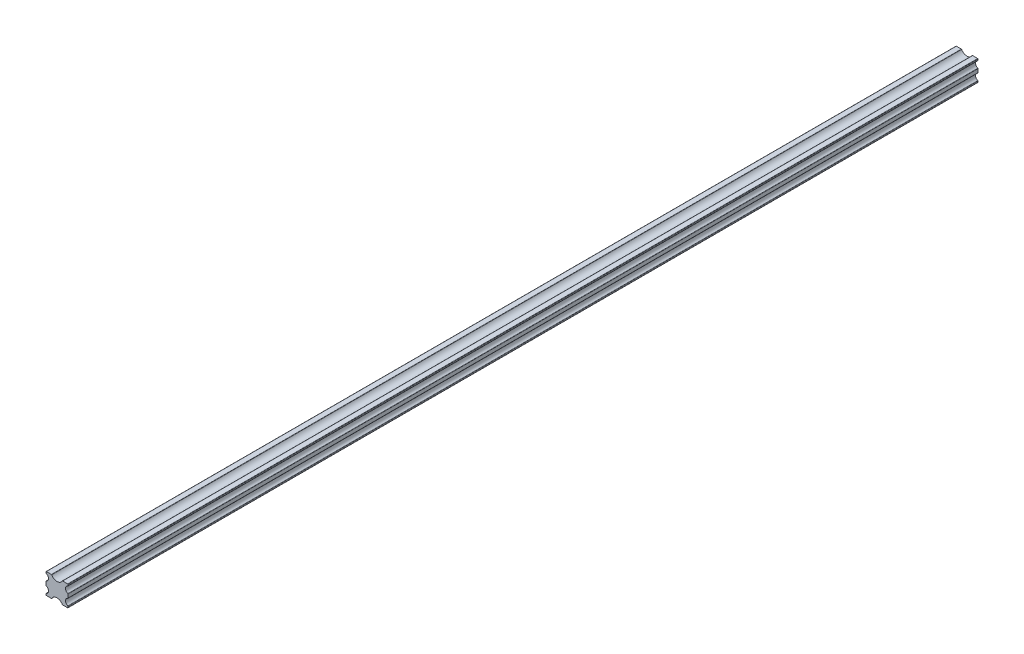
from build123d import *

# Parameters (mm, degrees)
SKETCH1_W           = 12.1
SKETCH1_H           = 11.4
BOSS_EXTRUDE1_DEPTH = 500
SKETCH2_R           = 3.379
SKETCH2_R_2         = 1.9
CUT_EXTRUDE1_DEPTH  = 501.069087727
FILLET1_R           = 0.2


with BuildPart() as part:
    # Sketch1 → Boss-Extrude1 (new body)
    with BuildSketch(Plane.XY):
        Rectangle(SKETCH1_W, SKETCH1_H)
    extrude(amount=BOSS_EXTRUDE1_DEPTH)

    # Sketch2 → Cut-Extrude1 (cut, through all)
    with BuildSketch(Plane.XY.offset(500)):
        with Locations((0, 7.279)):
            Circle(SKETCH2_R)
        with Locations((0, -7.279)):
            Circle(SKETCH2_R)
        with Locations((-6.565, 2.930166572)):
            Circle(SKETCH2_R_2)
        with Locations((-6.565, -2.930166572)):
            Circle(SKETCH2_R_2)
        with Locations((6.565, -2.930166572)):
            Circle(SKETCH2_R_2)
        with Locations((6.565, 2.930166572)):
            Circle(SKETCH2_R_2)
    extrude(amount=-CUT_EXTRUDE1_DEPTH, mode=Mode.SUBTRACT)

    # Fillet1
    fillet1_edges = [part.edges().sort_by_distance(p)[0] for p in [
        (6.05, -4.759039176, 250),
        (6.05, -1.101293968, 250),
        (-6.05, -1.101293968, 250),
        (-6.05, -4.759039176, 250),
        (-6.05, 4.759039176, 250),
        (-6.05, 1.101293968, 250),
        (-2.987373428, -5.7, 250),
        (2.987373428, -5.7, 250),
        (6.05, 1.101293968, 250),
        (6.05, 4.759039176, 250),
        (2.987373428, 5.7, 250),
        (-2.987373428, 5.7, 250),
        (6.05, -5.7, 250),
        (-6.05, -5.7, 250),
        (-6.05, 5.7, 250),
        (6.05, 5.7, 250),
    ]]
    fillet(fillet1_edges, radius=FILLET1_R)


solid = part.part
